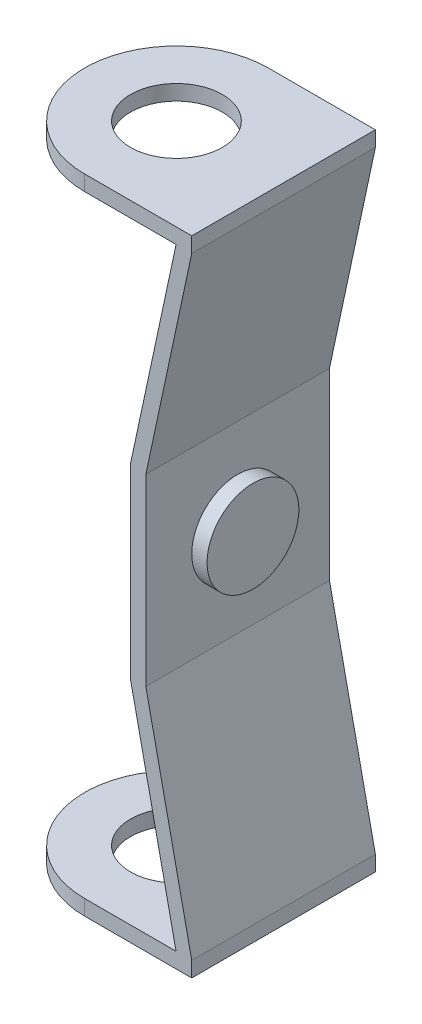
from build123d import *

# Parameters (mm, degrees)
EXTRUDE_2_DEPTH     = 30
SKETCH_4_R          = 15
CUT_EXTRUDE_1_DEPTH = 210
SKETCH_5_R          = 15
EXTRUDE_3_DEPTH     = 10
FILLET_1_R          = 4


with BuildPart() as part:
    # 스케치3 → 보스-돌출2 (new, symmetric)
    with BuildSketch(Plane.XY):
        Polygon((0, -30), (0, 30), (15, 100), (15, 105), (-50, 105), (-50, 100), (9.886492477, 100), (-5, 30.529701772), (-5, -30.529701772), (9.886492477, -100), (-50, -100), (-50, -105), (15, -105), (15, -100), align=None)
    extrude(amount=EXTRUDE_2_DEPTH, both=True)

    # 스케치4 → 컷-돌출1 (cut)
    with BuildSketch(Plane(origin=(0, 105, 0), x_dir=(1, 0, 0), z_dir=(0, 1, 0))):
        with Locations(Location((-20, 0, 0), (0, 0, 180))):
            Circle(SKETCH_4_R)
        with BuildLine():
            Line((-20, 30), (-20, 33.122933613))
            Line((-20, 33.122933613), (-53.393516075, 33.122933613))
            Line((-53.393516075, 33.122933613), (-53.393516075, -32.957525704))
            Line((-53.393516075, -32.957525704), (-20, -32.957525704))
            Line((-20, -32.957525704), (-20, -30))
            ThreePointArc((-20, -30), (-50, 0), (-20, 30))
        make_face()
    extrude(amount=-CUT_EXTRUDE_1_DEPTH, mode=Mode.SUBTRACT)

    # 스케치5 → 보스-돌출3 (add, symmetric)
    with BuildSketch(Plane.ZY.offset(5)):
        Circle(SKETCH_5_R)
    extrude(amount=EXTRUDE_3_DEPTH, both=True)

    # 필렛1
    fillet_1_edges = [part.edges().sort_by_distance(p)[0] for p in [
        (-15, 0, -15),
    ]]
    fillet(fillet_1_edges, radius=FILLET_1_R)


solid = part.part
